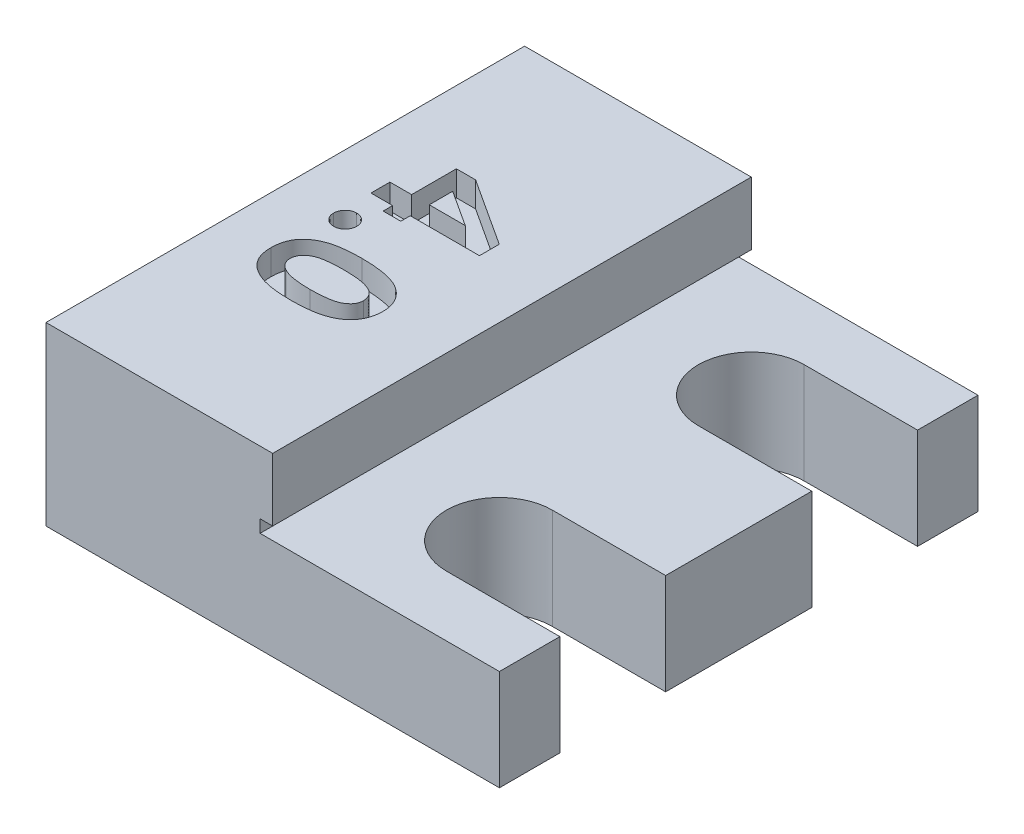
from build123d import *

# Parameters (mm, degrees)
BOSS_EXTRUDE1_DEPTH = 19
CUT_EXTRUDE1_DEPTH  = 28.092434368
CUT_EXTRUDE2_DEPTH  = 1
SKETCH4_W           = 6
SKETCH4_H           = 16
CUT_EXTRUDE3_DEPTH  = 5


with BuildPart() as part:
    # Sketch1 → Boss-Extrude1 (new body)
    with BuildSketch(Plane.XY):
        Polygon((0, 0), (18, 0), (18, 4), (9, 4), (8.5, 4), (8.5, 4.5), (9, 4.5), (9, 7), (0, 7), align=None)
    extrude(amount=BOSS_EXTRUDE1_DEPTH)

    # Sketch2 → Cut-Extrude1 (cut, through all)
    with BuildSketch(Plane(origin=(0, 7, 0), x_dir=(1, 0, 0), z_dir=(0, 1, 0))):
        with BuildLine():
            Line((13.5, -2.4), (18, -2.4))
            Line((18, -2.4), (18, -6.6))
            Line((18, -6.6), (13.5, -6.6))
            ThreePointArc((13.5, -6.6), (11.4, -4.5), (13.5, -2.4))
        make_face()
        with BuildLine():
            Line((13.5, -12.4), (18, -12.4))
            Line((18, -12.4), (18, -16.6))
            Line((18, -16.6), (13.5, -16.6))
            ThreePointArc((13.5, -16.6), (11.4, -14.5), (13.5, -12.4))
        make_face()
    extrude(amount=-CUT_EXTRUDE1_DEPTH, mode=Mode.SUBTRACT)

    # Sketch3 → Cut-Extrude2 (cut)
    # profile 1 of 3: a face of its own
    with BuildSketch(Plane(origin=(0, 7, 0), x_dir=(1, 0, 0), z_dir=(0, 1, 0))):
        Polygon((6.307692308, -7.314182692), (6.307692308, -8.1), (3.561538462, -8.1), (3.561538462, -8.476923077), (2.861538462, -8.476923077), (2.861538462, -8.1), (2, -8.1), (2, -7.346153846), (2.861538462, -7.346153846), (2.861538462, -5.569230769), (3.624639423, -5.569230769), align=None)
        Polygon((3.561538462, -7.346153846), (4.990985577, -7.346153846), (3.561538462, -6.416466346), align=None, mode=Mode.SUBTRACT)
    # profile 2 of 3: a face of its own
    with BuildSketch(Plane(origin=(0, 7, 0), x_dir=(1, 0, 0), z_dir=(0, 1, 0))):
        with BuildLine():
            add(Edge.make_bspline(
                [(2.861538462, -9.526923077), (2.85988287, -9.557362204), (2.856623295, -9.617291589), (2.831853959, -9.703995704), (2.788312606, -9.782702644), (2.730502257, -9.85257974), (2.661701966, -9.911911527), (2.582376507, -9.953401025), (2.496427686, -9.98023852), (2.436302157, -9.983133621), (2.405528846, -9.984615385)],
                knots=[0, 0, 0, 0, 1.016476041, 2.001265769, 2.982571086, 4.001334304, 5.018889842, 5.99575474, 6.974191785, 8, 8, 8, 8], degree=3))
            add(Edge.make_bspline(
                [(2.405528846, -9.984615385), (2.374750787, -9.983143332), (2.31461598, -9.980267206), (2.228495667, -9.95321757), (2.148526587, -9.911977622), (2.078984136, -9.852574786), (2.020088959, -9.78299344), (1.976959039, -9.703815063), (1.950796284, -9.617456418), (1.947716214, -9.557391196), (1.946153846, -9.526923077)],
                knots=[0, 0, 0, 0, 1.022731703, 1.998234309, 2.980426153, 4.002090265, 5.023754376, 6.00211665, 6.986572482, 8, 8, 8, 8], degree=3))
            add(Edge.make_bspline(
                [(1.946153846, -9.526923077), (1.947729022, -9.496462175), (1.950834344, -9.436411182), (1.976740674, -9.350186567), (2.020380314, -9.271588463), (2.078913136, -9.202024595), (2.14877397, -9.142885964), (2.228244922, -9.100439216), (2.314648555, -9.073639214), (2.374761815, -9.070723224), (2.405528846, -9.069230769)],
                knots=[0, 0, 0, 0, 1.013910294, 1.9988351, 2.969460266, 3.991611077, 5.013761889, 6.000813773, 6.976781088, 8, 8, 8, 8], degree=3))
            add(Edge.make_bspline(
                [(2.405528846, -9.069230769), (2.436290937, -9.070733066), (2.496394544, -9.073668284), (2.582630141, -9.100255237), (2.661453239, -9.142949764), (2.730573405, -9.202019856), (2.788023525, -9.271877769), (2.832069332, -9.350006935), (2.856584954, -9.436576095), (2.859869955, -9.496491201), (2.861538462, -9.526923077)],
                knots=[0, 0, 0, 0, 1.02629359, 2.005193596, 2.986963232, 4.00500024, 5.0242455, 5.997787305, 6.983042999, 8, 8, 8, 8], degree=3))
        make_face()
    # profile 3 of 3: a face of its own
    with BuildSketch(Plane(origin=(0, 7, 0), x_dir=(1, 0, 0), z_dir=(0, 1, 0))):
        with BuildLine():
            add(Edge.make_bspline(
                [(6.307692308, -11.937379808), (6.307150683, -11.973869128), (6.306085705, -12.045616881), (6.29454866, -12.151287171), (6.277124504, -12.25307935), (6.252805809, -12.351380113), (6.220685788, -12.445523764), (6.18190987, -12.536269402), (6.135550949, -12.622853881), (6.082281439, -12.705477488), (6.02270567, -12.784525027), (5.953841518, -12.857366744), (5.878739381, -12.926822083), (5.796159568, -12.991739367), (5.705539209, -13.051391781), (5.608078808, -13.106892863), (5.502860985, -13.157526901), (5.389778503, -13.20396373), (5.267117399, -13.245505969), (5.133456997, -13.280398151), (4.988893108, -13.310732399), (4.832672601, -13.334621473), (4.665163984, -13.354174114), (4.486053808, -13.366949594), (4.295843307, -13.375837098), (4.16535578, -13.376554506), (4.098317308, -13.376923077)],
                knots=[0, 0, 0, 0, 0.879087513, 1.728520926, 2.558587148, 3.366762743, 4.166157112, 4.95337177, 5.74258602, 6.530032775, 7.320866164, 8.124307838, 8.942260106, 9.784645725, 10.652593514, 11.554662219, 12.485739241, 13.464770064, 14.499274465, 15.604285219, 16.792026686, 18.057713884, 19.411711354, 20.855437135, 22.384468668, 24, 24, 24, 24], degree=3))
            add(Edge.make_bspline(
                [(4.098317308, -13.376923077), (4.030440525, -13.37652196), (3.898557155, -13.375742597), (3.70660119, -13.367345458), (3.526210383, -13.3528853), (3.357403645, -13.334247649), (3.200269274, -13.308720394), (3.054403265, -13.278820445), (2.919848806, -13.243303124), (2.79694166, -13.200378221), (2.68359105, -13.154337682), (2.578944999, -13.103208582), (2.481123496, -13.050067474), (2.391489769, -12.991693005), (2.309846766, -12.929325786), (2.235444428, -12.863944923), (2.169307235, -12.794157234), (2.110069404, -12.7210064), (2.058216793, -12.642714885), (2.01366831, -12.55962707), (1.976853175, -12.471182306), (1.9451208, -12.378667246), (1.922290893, -12.280436063), (1.90419103, -12.178005479), (1.894184694, -12.070231506), (1.892943628, -11.99685416), (1.892307692, -11.959254808)],
                knots=[0, 0, 0, 0, 1.643682949, 3.193646483, 4.651618242, 6.025629174, 7.305184366, 8.505292942, 9.630500342, 10.672179876, 11.655924581, 12.591484594, 13.491256898, 14.350247848, 15.17884557, 15.977481787, 16.746098769, 17.504475725, 18.254166354, 19.016819136, 19.783753977, 20.571954997, 21.382401421, 22.223156612, 23.089526058, 24, 24, 24, 24], degree=3))
            add(Edge.make_bspline(
                [(1.892307692, -11.959254808), (1.892958632, -11.921657209), (1.894233814, -11.848004067), (1.904086281, -11.739928272), (1.922520224, -11.636723558), (1.944975925, -11.537578193), (1.977024282, -11.443362893), (2.014430371, -11.353389364), (2.059233294, -11.268105532), (2.110855853, -11.187457673), (2.170065111, -11.11173783), (2.236213665, -11.03976485), (2.309137681, -10.971699163), (2.389652904, -10.908575843), (2.476684941, -10.84936136), (2.571227482, -10.794672603), (2.673143257, -10.744544816), (2.782572889, -10.697400516), (2.901878097, -10.656467963), (3.032100284, -10.619915704), (3.174468576, -10.590475047), (3.328448015, -10.564687625), (3.494578206, -10.547373), (3.672092814, -10.532564683), (3.861539617, -10.524279313), (3.991739434, -10.523485583), (4.058774038, -10.523076923)],
                knots=[0, 0, 0, 0, 0.917197984, 1.796777363, 2.643741708, 3.473481078, 4.273990801, 5.068160217, 5.848535553, 6.620952589, 7.401027954, 8.190319769, 9.003592045, 9.831693788, 10.683727512, 11.569696396, 12.49373307, 13.453184301, 14.474457586, 15.568383184, 16.750575061, 18.019320986, 19.375517054, 20.823796471, 22.364701649, 24, 24, 24, 24], degree=3))
            add(Edge.make_bspline(
                [(4.058774038, -10.523076923), (4.151913091, -10.523808273), (4.331626093, -10.525219423), (4.591295751, -10.542644047), (4.83113749, -10.569002763), (5.051441104, -10.605085819), (5.251775391, -10.653685764), (5.432082806, -10.713328421), (5.594148159, -10.781764373), (5.690172203, -10.839987872), (5.736418269, -10.868028846)],
                knots=[0, 0, 0, 0, 1.288526675, 2.486228817, 3.599112392, 4.626206381, 5.5730174, 6.447949553, 7.252518174, 8, 8, 8, 8], degree=3))
            add(Edge.make_bspline(
                [(5.736418269, -10.868028846), (5.781849131, -10.900640072), (5.870675418, -10.964401446), (5.987287729, -11.07588999), (6.087020287, -11.195669914), (6.167616056, -11.326201431), (6.231173886, -11.46542013), (6.276064066, -11.614521274), (6.302219176, -11.772954258), (6.305840687, -11.881752831), (6.307692308, -11.937379808)],
                knots=[0, 0, 0, 0, 1.058512271, 2.069600068, 3.047294572, 4.004278952, 4.967380941, 5.939006123, 6.946246673, 8, 8, 8, 8], degree=3))
        make_face()
        with BuildLine():
            add(Edge.make_bspline(
                [(5.553846154, -11.955889423), (5.552270668, -11.922908887), (5.54918188, -11.858249528), (5.523401693, -11.764568479), (5.48271655, -11.676626924), (5.434760512, -11.609308285), (5.387973655, -11.559148094), (5.34693293, -11.522793846), (5.298932536, -11.490234906), (5.246047261, -11.458820008), (5.186821663, -11.430869169), (5.12274956, -11.403076295), (5.051691887, -11.380433104), (4.974987834, -11.358133021), (4.89047493, -11.338636996), (4.797488532, -11.322180048), (4.695329433, -11.307988824), (4.584245274, -11.296006011), (4.463793783, -11.288387596), (4.3342554, -11.281014932), (4.195362046, -11.278331006), (4.099719168, -11.277402337), (4.050360577, -11.276923077)],
                knots=[0, 0, 0, 0, 1.076821401, 2.111141558, 3.153197101, 4.23200803, 4.796476379, 5.394298193, 6.020090776, 6.690078086, 7.403703365, 8.159894791, 8.971856079, 9.83973388, 10.771758647, 11.806038152, 12.926526118, 14.143777411, 15.458313878, 16.872423957, 18.385946227, 20, 20, 20, 20], degree=3))
            add(Edge.make_bspline(
                [(4.050360577, -11.276923077), (3.986412475, -11.277690687), (3.863787247, -11.279162637), (3.687454343, -11.286901656), (3.526954651, -11.302324436), (3.381298609, -11.321757427), (3.251038899, -11.348230248), (3.136135085, -11.381192718), (3.035736471, -11.41774611), (2.951319527, -11.463577141), (2.879125714, -11.512681076), (2.816674456, -11.565091786), (2.764651799, -11.621723368), (2.720485601, -11.680883073), (2.687689615, -11.744764797), (2.663780285, -11.812058623), (2.649202201, -11.882913935), (2.647175838, -11.931423642), (2.646153846, -11.955889423)],
                knots=[0, 0, 0, 0, 1.772047989, 3.398033405, 4.888860297, 6.238411839, 7.468309579, 8.567754056, 9.549141588, 10.421774021, 11.221426488, 11.965694757, 12.675067502, 13.348095901, 14.005005053, 14.656328889, 15.322321954, 16, 16, 16, 16], degree=3))
            add(Edge.make_bspline(
                [(2.646153846, -11.955889423), (2.64685234, -11.979516527), (2.648219904, -12.025775459), (2.662257763, -12.093231342), (2.685080272, -12.157022417), (2.717364314, -12.216956081), (2.758418413, -12.273246707), (2.808422978, -12.325619182), (2.867876439, -12.373678523), (2.911999699, -12.401678113), (2.934735577, -12.416105769)],
                knots=[0, 0, 0, 0, 0.992283464, 1.942767638, 2.88273346, 3.832339453, 4.79467288, 5.803907806, 6.868395428, 8, 8, 8, 8], degree=3))
            add(Edge.make_bspline(
                [(2.934735577, -12.416105769), (2.965802388, -12.43309715), (3.030946973, -12.468726699), (3.140897888, -12.509852713), (3.264748166, -12.544936354), (3.403499208, -12.573060354), (3.556594281, -12.59533645), (3.724147171, -12.61236653), (3.906398045, -12.62101668), (4.032684545, -12.622372359), (4.098317308, -12.623076923)],
                knots=[0, 0, 0, 0, 0.710996797, 1.490902623, 2.352723643, 3.296875318, 4.334065587, 5.461510359, 6.680713396, 8, 8, 8, 8], degree=3))
            add(Edge.make_bspline(
                [(4.098317308, -12.623076923), (4.164517758, -12.622799909), (4.291942324, -12.622266703), (4.474875271, -12.612483906), (4.641954183, -12.598860635), (4.79280593, -12.578933654), (4.927797071, -12.55329418), (5.046917647, -12.521692777), (5.150406, -12.484439109), (5.238147698, -12.440254292), (5.312742503, -12.391337042), (5.37665067, -12.339343271), (5.431670617, -12.284183068), (5.476266621, -12.225262109), (5.511810773, -12.162973601), (5.536033359, -12.096981471), (5.55093428, -12.027505248), (5.552862428, -11.980083575), (5.553846154, -11.955889423)],
                knots=[0, 0, 0, 0, 1.793903324, 3.452957663, 4.963427329, 6.336122014, 7.574844885, 8.684777121, 9.673127442, 10.55010789, 11.340650774, 12.086136756, 12.779466299, 13.446812155, 14.083183996, 14.715685896, 15.34475337, 16, 16, 16, 16], degree=3))
        make_face(mode=Mode.SUBTRACT)
    extrude(amount=-CUT_EXTRUDE2_DEPTH, mode=Mode.SUBTRACT)

    # Sketch4 → Cut-Extrude3 (cut)
    with BuildSketch(Plane.XZ):
        with Locations((4.5, 9.5)):
            Rectangle(SKETCH4_W, SKETCH4_H)
    extrude(amount=-CUT_EXTRUDE3_DEPTH, mode=Mode.SUBTRACT)


solid = part.part
